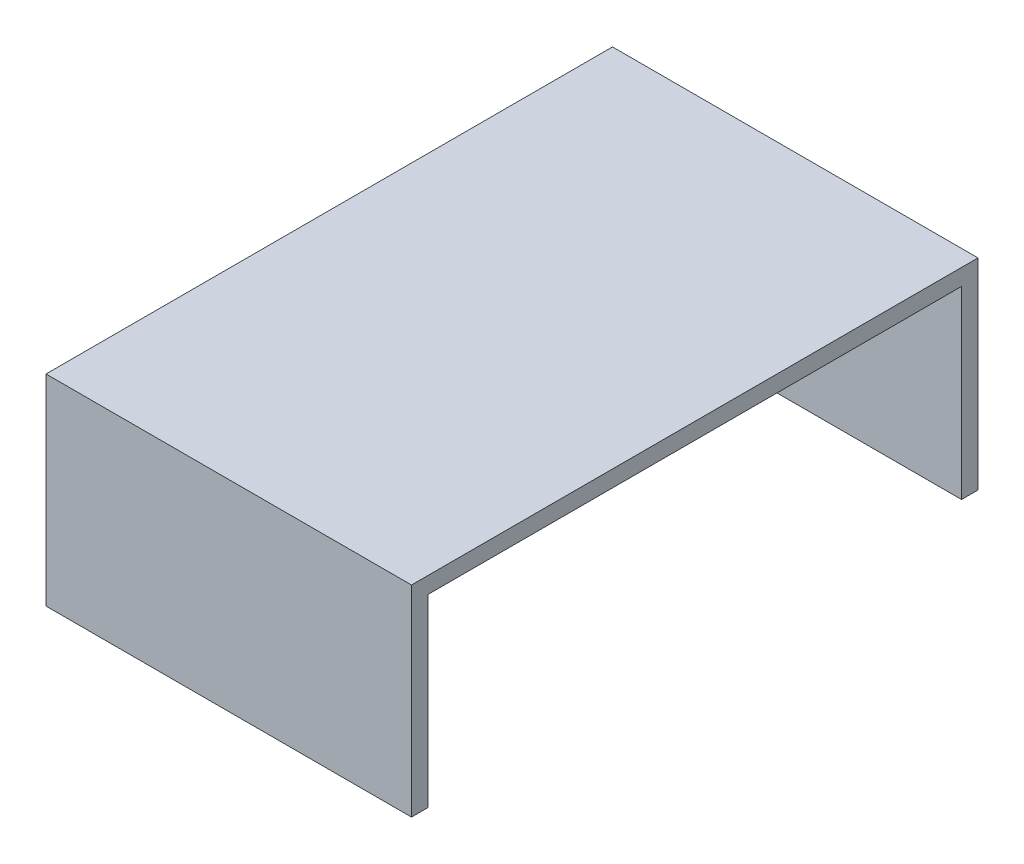
from build123d import *

# Parameters (mm, degrees)
SALIENTE_EXTRUIR1_DEPTH = 10


with BuildPart() as part:
    # Croquis1 → Saliente-Extruir1 (new body)
    with BuildSketch(Plane(origin=(10, 0, 0), x_dir=(0, 0, -1), z_dir=(1, 0, 0))):
        Polygon((7.75, 0), (-7.75, 0), (-7.75, -5.5), (-7.3, -5.5), (-7.3, -0.45), (7.3, -0.45), (7.3, -5.5), (7.75, -5.5), align=None)
    extrude(amount=-SALIENTE_EXTRUIR1_DEPTH)


solid = part.part
